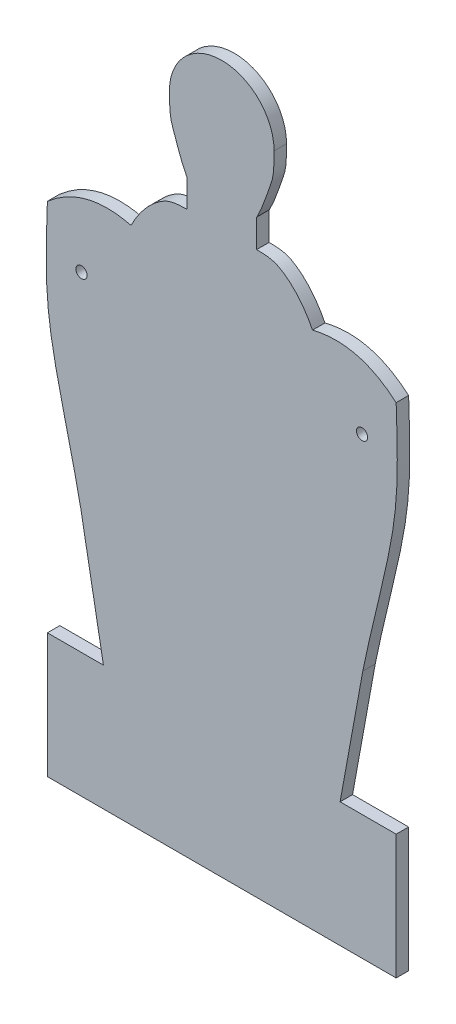
from build123d import *

# Parameters (mm, degrees)
RESSALTO_EXTRUS_O1_DEPTH = 5
ESBO_O3_R                = 2.25
CORTE_EXTRUS_O1_DEPTH    = 293.648462736


with BuildPart() as part:
    # Esboço1 → Ressalto-extrusão1 (new body)
    with BuildSketch(Plane.XY):
        with BuildLine():
            Line((-70, 50), (-70, 0))
            Line((-70, 0), (70, 0))
            Line((70, 0), (70, 50))
            Line((70, 50), (47.5, 50))
            Line((47.5, 50), (56.60599572, 100))
            add(Edge.make_bspline(
                [(56.60599572, 100), (58.822881578, 111.230467147), (70.624101453, 157.653217098), (70.983496175, 170.948411875), (70, 200)],
                knots=[0, 0, 0, 0, 0.304799144, 1, 1, 1, 1], degree=3))
            add(Edge.make_bspline(
                [(70, 200), (54.940172813, 213.077606657), (36.4, 208.4)],
                knots=[0, 0, 0, 1, 1, 1], degree=2))
            add(Edge.make_bspline(
                [(36.4, 208.4), (36.384425779, 208.408148411), (31.853718899, 218.695035342), (19.625229428, 225.496752597), (14.287120073, 225.126645694), (14, 225.2)],
                knots=[0, 0, 0, 0, 0.552885048, 0.635199122, 0.823140743, 0.823140743, 0.823140743, 0.823140743], degree=3))
            Line((14, 225.2), (14, 236.488415854))
            ThreePointArc((14, 236.488415854), (14.0946545, 236.599459291), (14.172142078, 236.723095026))
            add(Edge.make_bspline(
                [(14.172142078, 236.723095026), (16.438682622, 241.005058154), (19.848023934, 251.961326161), (20.98093901, 253.933353369), (21, 263)],
                knots=[0.009275677, 0.009275677, 0.009275677, 0.009275677, 0.377960332, 0.746644988, 0.746644988, 0.746644988, 0.746644988], degree=3))
            ThreePointArc((21, 263), (0, 284), (-21, 263))
            add(Edge.make_bspline(
                [(-14.172142078, 236.723095026), (-16.438682622, 241.005058154), (-19.848023934, 251.961326161), (-20.98093901, 253.933353369), (-21, 263)],
                knots=[0.009275677, 0.009275677, 0.009275677, 0.009275677, 0.377960332, 0.746644988, 0.746644988, 0.746644988, 0.746644988], degree=3))
            ThreePointArc((-14.172142078, 236.723095026), (-14.0946545, 236.599459291), (-14, 236.488415854))
            Line((-14, 236.488415854), (-14, 225.2))
            add(Edge.make_bspline(
                [(-36.4, 208.4), (-36.384425779, 208.408148411), (-31.853718899, 218.695035342), (-19.625229428, 225.496752597), (-14.287120073, 225.126645694), (-14, 225.2)],
                knots=[0, 0, 0, 0, 0.552885048, 0.635199122, 0.823140743, 0.823140743, 0.823140743, 0.823140743], degree=3))
            add(Edge.make_bspline(
                [(-70, 200), (-54.940172813, 213.077606657), (-36.4, 208.4)],
                knots=[0, 0, 0, 1, 1, 1], degree=2))
            add(Edge.make_bspline(
                [(-56.60599572, 100), (-58.822881578, 111.230467147), (-70.624101453, 157.653217098), (-70.983496175, 170.948411875), (-70, 200)],
                knots=[0, 0, 0, 0, 0.304799144, 1, 1, 1, 1], degree=3))
            Line((-56.60599572, 100), (-47.5, 50))
            Line((-47.5, 50), (-70, 50))
        make_face()
    extrude(amount=RESSALTO_EXTRUS_O1_DEPTH)

    # Esboço3 → Corte-extrusão1 (cut, through all)
    with BuildSketch(Plane.XY.offset(5)):
        with Locations((-56.3, 182.2)):
            Circle(ESBO_O3_R)
        with Locations(Location((56.3, 182.2, 0), (0, 0, 180))):
            Circle(ESBO_O3_R)
    extrude(amount=-CORTE_EXTRUS_O1_DEPTH, mode=Mode.SUBTRACT)


solid = part.part
